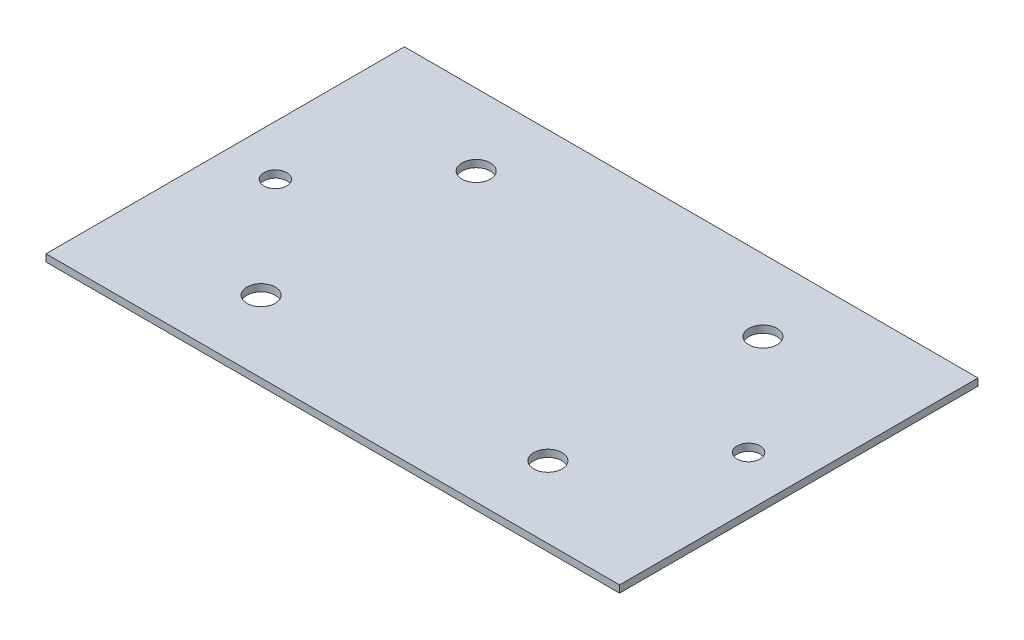
from build123d import *

# Parameters (mm, degrees)
SKETCH1_W           = 80
SKETCH1_H           = 50
SKETCH1_R           = 1.975
SKETCH1_R_2         = 1.6
BOSS_EXTRUDE1_DEPTH = 1


with BuildPart() as part:
    # Sketch1 → Boss-Extrude1 (new body)
    with BuildSketch(Plane(origin=(0, 0, 0), x_dir=(1, 0, 0), z_dir=(0, 1, 0))):
        with Locations((40, 25)):
            Rectangle(SKETCH1_W, SKETCH1_H)
        with Locations(Location((20, 40, 0), (0, 0, 270))):
            Circle(SKETCH1_R, mode=Mode.SUBTRACT)
        with Locations(Location((60, 40, 0), (0, 0, 270))):
            Circle(SKETCH1_R, mode=Mode.SUBTRACT)
        with Locations(Location((20, 10, 0), (0, 0, 270))):
            Circle(SKETCH1_R, mode=Mode.SUBTRACT)
        with Locations(Location((60, 10, 0), (0, 0, 270))):
            Circle(SKETCH1_R, mode=Mode.SUBTRACT)
        with Locations(Location((7, 25, 0), (0, 0, 270))):
            Circle(SKETCH1_R_2, mode=Mode.SUBTRACT)
        with Locations(Location((73, 25, 0), (0, 0, 270))):
            Circle(SKETCH1_R_2, mode=Mode.SUBTRACT)
    extrude(amount=BOSS_EXTRUDE1_DEPTH)


solid = part.part
